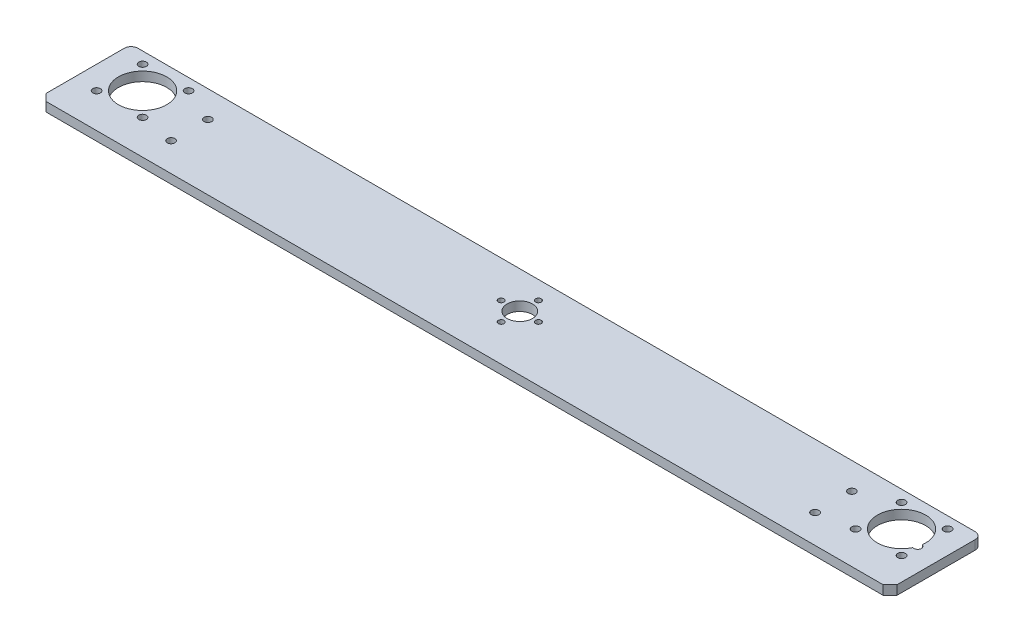
from build123d import *

# Parameters (mm, degrees)
SKETCH1_W                 = 370
SKETCH1_H                 = 40
BOSS_EXTRUDE1_DEPTH       = 4
CUT_EXTRUDE1_REACH        = 188.121
SKETCH2_R                 = 10.5
SKETCH2_R_2               = 5.5
M4X0_7_TAPPED_HOLE1_D     = 3.3
M4X0_7_TAPPED_HOLE1_DEPTH = 4
CHAMFER1_SIZE             = 3
FILLET1_R                 = 3
M3X0_5_TAPPED_HOLE1_D     = 2.5


with BuildPart() as part:
    # Sketch1 → Boss-Extrude1 (new body)
    with BuildSketch(Plane(origin=(0, 0, 0), x_dir=(1, 0, 0), z_dir=(0, 1, 0))):
        Rectangle(SKETCH1_W, SKETCH1_H)
    extrude(amount=BOSS_EXTRUDE1_DEPTH)

    # Sketch2 → Cut-Extrude1 (cut, up to next)
    with BuildSketch(Plane(origin=(0, 4, 0), x_dir=(1, 0, 0), z_dir=(0, 1, 0)), mode=Mode.PRIVATE) as cut_extrude1_sk1:
        with Locations(Location((165, 5, 0), (0, 0, 270))):
            Circle(SKETCH2_R)
    cut_extrude1_tool1 = extrude(cut_extrude1_sk1.sketch, amount=-CUT_EXTRUDE1_REACH, mode=Mode.PRIVATE) & part.part
    # Sketch2 → Cut-Extrude1 (cut, up to next)
    with BuildSketch(Plane(origin=(0, 4, 0), x_dir=(1, 0, 0), z_dir=(0, 1, 0)), mode=Mode.PRIVATE) as cut_extrude1_sk2:
        with Locations(Location((-165, 5, 0), (0, 0, 270))):
            Circle(SKETCH2_R)
    cut_extrude1_tool2 = extrude(cut_extrude1_sk2.sketch, amount=-CUT_EXTRUDE1_REACH, mode=Mode.PRIVATE) & part.part
    # Sketch2 → Cut-Extrude1 (cut, up to next)
    with BuildSketch(Plane(origin=(0, 4, 0), x_dir=(1, 0, 0), z_dir=(0, 1, 0)), mode=Mode.PRIVATE) as cut_extrude1_sk3:
        with Locations(Location((0, 4, 0), (0, 0, 270))):
            Circle(SKETCH2_R_2)
    cut_extrude1_tool3 = extrude(cut_extrude1_sk3.sketch, amount=-CUT_EXTRUDE1_REACH, mode=Mode.PRIVATE) & part.part
    add(cut_extrude1_tool1.solids().sort_by_distance((165, 4, -5))[0], mode=Mode.SUBTRACT)
    add(cut_extrude1_tool2.solids().sort_by_distance((-165, 4, -5))[0], mode=Mode.SUBTRACT)
    add(cut_extrude1_tool3.solids().sort_by_distance((0, 4, -4))[0], mode=Mode.SUBTRACT)

    # M4x0.7 Tapped Hole1
    with Locations(Plane(origin=(0, 4, 0), x_dir=(1, 0, 0), z_dir=(0, 1, 0))):
        with Locations((175, 2), (155, 15), (175, 15), (155, -5), (175, -5), (-175, 15), (-155, 15), (-175, -5), (-155, -5), (-140, 8.394191797), (-140, -7.610688145), (140, 8.394191797), (140, -7.610688145)):
            Hole(M4X0_7_TAPPED_HOLE1_D / 2, depth=M4X0_7_TAPPED_HOLE1_DEPTH)

    # Chamfer1
    chamfer1_edges = [part.edges().sort_by_distance(p)[0] for p in [
        (185, 2, 20),
        (-185, 2, 20),
    ]]
    chamfer(chamfer1_edges, length=CHAMFER1_SIZE)

    # Fillet1
    fillet1_edges = [part.edges().sort_by_distance(p)[0] for p in [
        (-185, 2, -20),
        (185, 2, -20),
    ]]
    fillet(fillet1_edges, radius=FILLET1_R)

    # M3x0.5 Tapped Hole1 (through all)
    with Locations(Plane(origin=(0, 4, 0), x_dir=(1, 0, 0), z_dir=(0, 1, 0))):
        with Locations((0, 12.1), (8.1, 4), (0, -4.1), (-8.1, 4)):
            Hole(M3X0_5_TAPPED_HOLE1_D / 2)


solid = part.part
